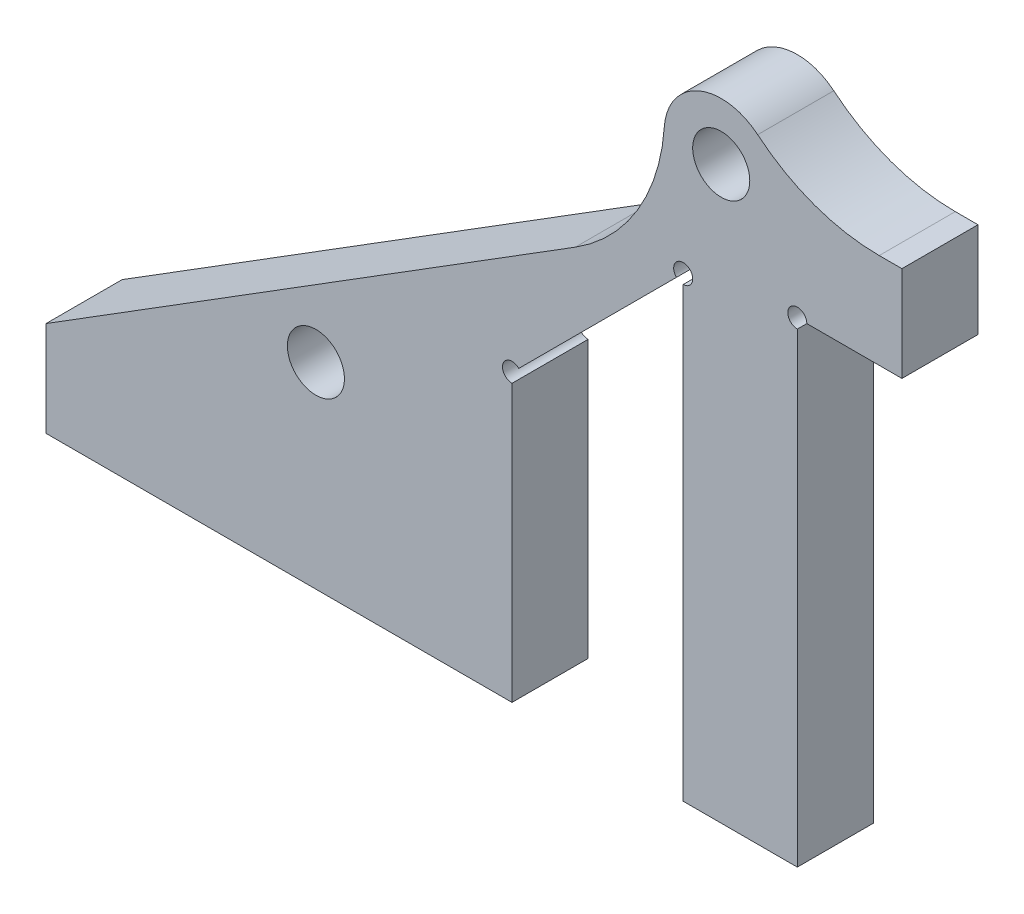
from build123d import *

# Parameters (mm, degrees)
EXTRUDE_1_DEPTH     = 4
SKETCH_2_R          = 1.5
EXTRUDE_2_DEPTH     = 4
SKETCH_3_R          = 1.5
CUT_EXTRUDE_1_DEPTH = 4
FILLET_1_R          = 10
SKETCH_4_R          = 0.5
CUT_EXTRUDE_2_DEPTH = 4


with BuildPart() as part:
    # 草图1 → 凸台-拉伸1 (new body)
    with BuildSketch(Plane.XY):
        Polygon((-5.5, 0), (-11.5, 0), (-11.5, 24.03), (-20.5, 15.03), (-20.5, 0), (-45, 0), (-45, 5), (-5, 30), (0, 30), (0, 25), (-5.5, 25), align=None)
    extrude(amount=EXTRUDE_1_DEPTH)

    # 草图2 → 凸台-拉伸2 (add)
    with BuildSketch(Plane.XY.offset(4)):
        with BuildLine():
            Line((-6.5, 30), (-5, 30))
            Line((-5, 30), (-12.5, 25.3125))
            Line((-12.5, 25.3125), (-12.5, 30))
            ThreePointArc((-12.5, 30), (-9.5, 33), (-6.5, 30))
        make_face()
        with Locations((-9.5, 30)):
            Circle(SKETCH_2_R, mode=Mode.SUBTRACT)
    extrude(amount=-EXTRUDE_2_DEPTH)

    # 草图3 → 切除-拉伸1 (cut)
    with BuildSketch(Plane.XY.offset(4)):
        with Locations((-30.810217499, 10.330871139)):
            Circle(SKETCH_3_R)
    extrude(amount=-CUT_EXTRUDE_1_DEPTH, mode=Mode.SUBTRACT)

    # 圆角1
    fillet_1_edges = [part.edges().sort_by_distance(p)[0] for p in [
        (-6.5, 30, 2),
        (-12.5, 25.3125, 2),
    ]]
    fillet(fillet_1_edges, radius=FILLET_1_R)

    # 草图4 → 切除-拉伸2 (cut)
    with BuildSketch(Plane.XY.offset(4)):
        with Locations((-5.5, 25)):
            Circle(SKETCH_4_R)
        with Locations((-11.5, 24.03)):
            Circle(SKETCH_4_R)
        with Locations((-20.5, 15.03)):
            Circle(SKETCH_4_R)
    extrude(amount=-CUT_EXTRUDE_2_DEPTH, mode=Mode.SUBTRACT)


solid = part.part
